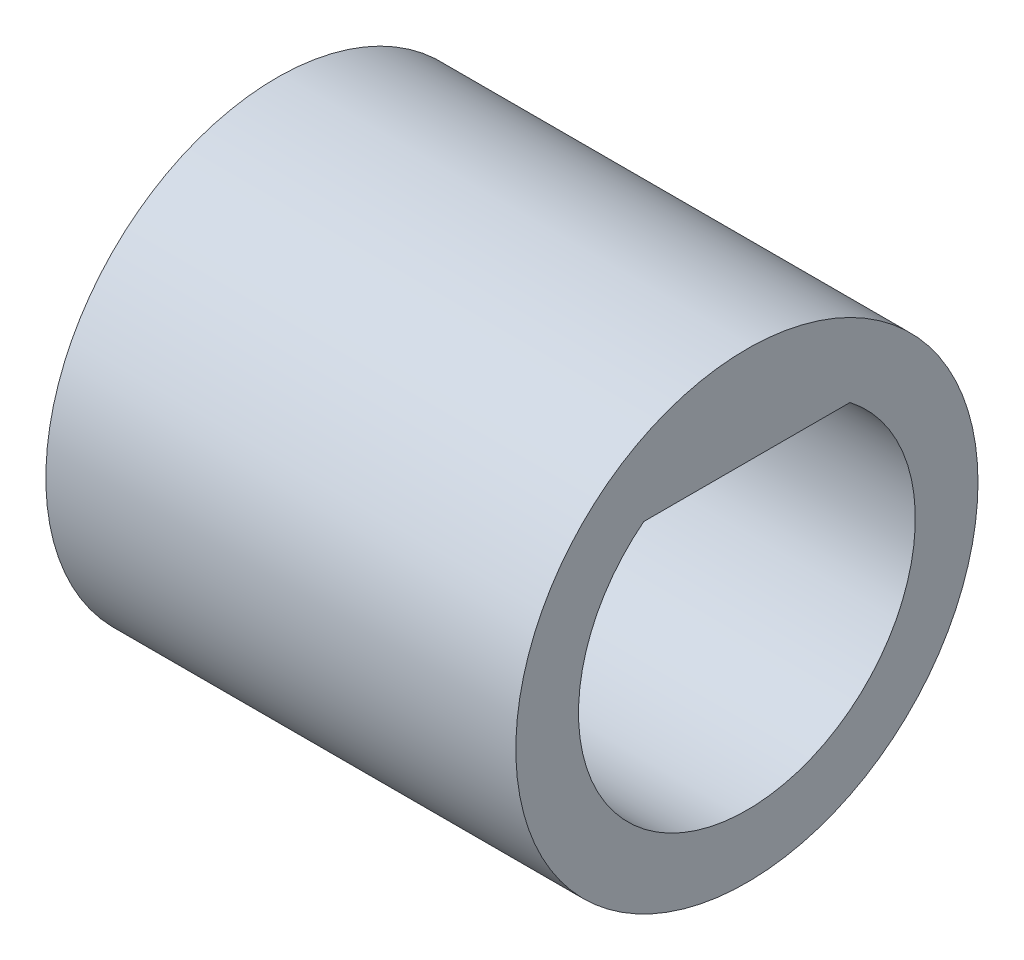
from build123d import *

# Parameters (mm, degrees)
SKETCH5_R           = 2.95
BOSS_EXTRUDE2_DEPTH = 6
CUT_EXTRUDE1_DEPTH  = 5


with BuildPart() as part:
    # Sketch5 → Boss-Extrude2 (new body)
    with BuildSketch(Plane(origin=(0, 0, 0), x_dir=(0, 0, -1), z_dir=(1, 0, 0))):
        Circle(SKETCH5_R)
    extrude(amount=BOSS_EXTRUDE2_DEPTH)

    # Sketch7 → Cut-Extrude1 (cut)
    with BuildSketch(Plane(origin=(6, 0, 0), x_dir=(0, 0, -1), z_dir=(1, 0, 0))):
        with BuildLine():
            Line((-1.316244658, 1.7), (1.316244658, 1.7))
            ThreePointArc((1.316244658, 1.7), (0, -2.15), (-1.316244658, 1.7))
        make_face()
    extrude(amount=-CUT_EXTRUDE1_DEPTH, mode=Mode.SUBTRACT)


solid = part.part
